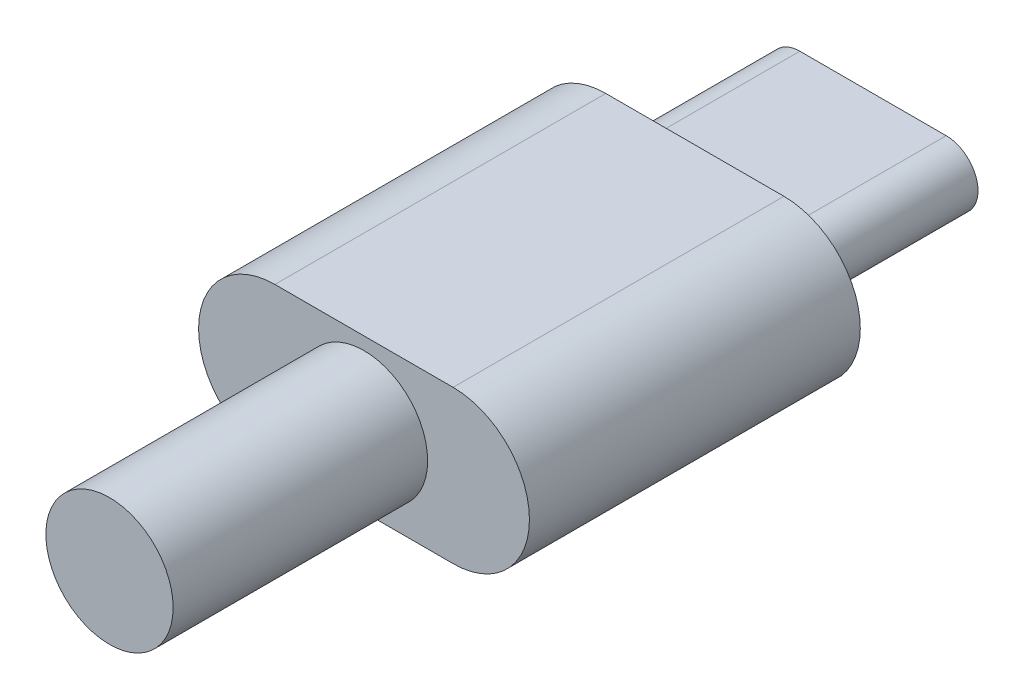
from build123d import *

# Parameters (mm, degrees)
BOSS_EXTRUDE1_DEPTH = 7
BOSS_EXTRUDE2_DEPTH = 13
SKETCH3_R           = 2.5
BOSS_EXTRUDE3_DEPTH = 10


with BuildPart() as part:
    # Sketch1 → Boss-Extrude1 (new body)
    with BuildSketch(Plane.XY):
        with BuildLine():
            Line((-2.875, 1.25), (2.875, 1.25))
            ThreePointArc((2.875, 1.25), (4.125, 0), (2.875, -1.25))
            Line((2.875, -1.25), (-2.875, -1.25))
            ThreePointArc((-2.875, -1.25), (-4.125, 0), (-2.875, 1.25))
        make_face()
    extrude(amount=BOSS_EXTRUDE1_DEPTH)

    # Sketch2 → Boss-Extrude2 (add)
    with BuildSketch(Plane.XY.offset(7)):
        with BuildLine():
            Line((-3.5, 3), (3.5, 3))
            ThreePointArc((3.5, 3), (6.5, 0), (3.5, -3))
            Line((3.5, -3), (-3.5, -3))
            ThreePointArc((-3.5, -3), (-6.5, 0), (-3.5, 3))
        make_face()
    extrude(amount=BOSS_EXTRUDE2_DEPTH)

    # Sketch3 → Boss-Extrude3 (add)
    with BuildSketch(Plane.XY.offset(20)):
        Circle(SKETCH3_R)
    extrude(amount=BOSS_EXTRUDE3_DEPTH)


solid = part.part
